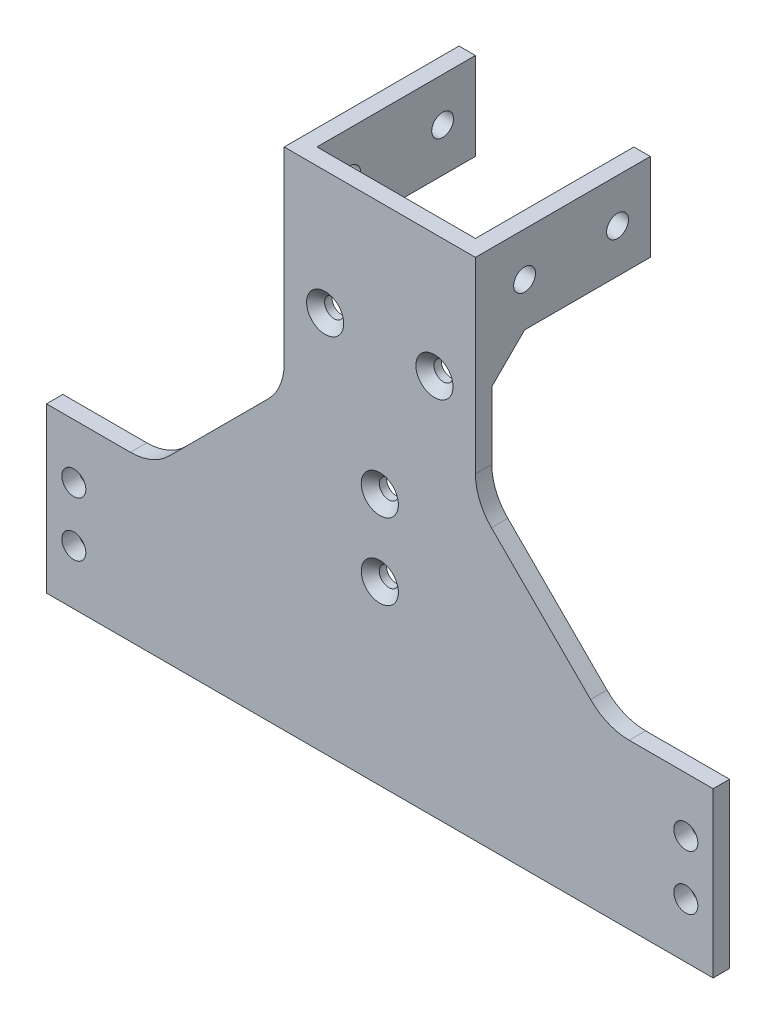
from build123d import *

# Parameters (mm, degrees)
SKETCH1_W           = 122
SKETCH1_H           = 30
SKETCH1_R           = 2.2
BOSS_EXTRUDE1_DEPTH = 3
SKETCH2_W           = 35
SKETCH2_H           = 62.46
SKETCH2_R           = 1.75
BOSS_EXTRUDE2_DEPTH = 3
BOSS_EXTRUDE3_DEPTH = 3
FILLET1_R           = 10
CHAMFER1_SIZE       = 1.65
SKETCH4_W           = 32
SKETCH4_H           = 16
SKETCH4_R           = 2
BOSS_EXTRUDE4_DEPTH = 3
CHAMFER2_SIZE       = 6


with BuildPart() as part:
    # Sketch1 → Boss-Extrude1 (new body)
    with BuildSketch(Plane.XY):
        Rectangle(SKETCH1_W, SKETCH1_H)
        with Locations((-56, 5)):
            Circle(SKETCH1_R, mode=Mode.SUBTRACT)
        with Locations(Location((-56, -5, 0), (0, 0, 180))):
            Circle(SKETCH1_R, mode=Mode.SUBTRACT)
        with Locations((56, -5)):
            Circle(SKETCH1_R, mode=Mode.SUBTRACT)
        with Locations(Location((56, 5, 0), (0, 0, 180))):
            Circle(SKETCH1_R, mode=Mode.SUBTRACT)
    extrude(amount=BOSS_EXTRUDE1_DEPTH)

    # Sketch2 → Boss-Extrude2 (add)
    with BuildSketch(Plane.XY.offset(3)):
        with Locations((0, 46.23)):
            Rectangle(SKETCH2_W, SKETCH2_H)
        with Locations((0, 17.3)):
            Circle(SKETCH2_R, mode=Mode.SUBTRACT)
        with Locations((10, 54.9)):
            Circle(SKETCH2_R, mode=Mode.SUBTRACT)
        with Locations((0, 31.2)):
            Circle(SKETCH2_R, mode=Mode.SUBTRACT)
        with Locations(Location((-10, 54.9, 0), (0, 0, 180))):
            Circle(SKETCH2_R, mode=Mode.SUBTRACT)
    extrude(amount=-BOSS_EXTRUDE2_DEPTH)

    # Sketch3 → Boss-Extrude3 (add)
    with BuildSketch(Plane.XY.offset(3)):
        Polygon((-41.5, 15), (-17.5, 39), (-17.5, 15), align=None)
        Polygon((17.5, 39), (17.5, 15), (41.5, 15), align=None)
    extrude(amount=-BOSS_EXTRUDE3_DEPTH)

    # Fillet1
    fillet1_edges = [part.edges().sort_by_distance(p)[0] for p in [
        (-41.5, 15, 1.5),
        (-17.5, 39, 1.5),
        (17.5, 39, 1.5),
        (41.5, 15, 1.5),
    ]]
    fillet(fillet1_edges, radius=FILLET1_R)

    # Chamfer1
    chamfer1_edges = [part.edges().sort_by_distance(p)[0] for p in [
        (-1.75, 17.3, 3),
        (8.25, 54.9, 3),
        (-1.75, 31.2, 3),
        (-8.25, 54.9, 3),
    ]]
    chamfer(chamfer1_edges, length=CHAMFER1_SIZE)

    # Sketch4 → Boss-Extrude4 (add)
    with BuildSketch(Plane(origin=(17.5, 0, 0), x_dir=(0, 0, -1), z_dir=(1, 0, 0))):
        with Locations((13, 69.46)):
            Rectangle(SKETCH4_W, SKETCH4_H)
        with Locations(Location((23, 69.46, 0), (0, 0, 90))):
            Circle(SKETCH4_R, mode=Mode.SUBTRACT)
        with Locations(Location((6, 69.46, 0), (0, 0, 270))):
            Circle(SKETCH4_R, mode=Mode.SUBTRACT)
    boss_extrude4 = extrude(amount=-BOSS_EXTRUDE4_DEPTH)

    # Mirror1: Boss-Extrude4 across plane
    add(boss_extrude4.mirror(Plane(origin=(0, 0, 0), x_dir=(0, 0, 1), z_dir=(1, 0, 0))))

    # Chamfer2
    chamfer2_edges = [part.edges().sort_by_distance(p)[0] for p in [
        (16, 61.46, 0),
        (-16, 61.46, 0),
    ]]
    chamfer(chamfer2_edges, length=CHAMFER2_SIZE)


solid = part.part
